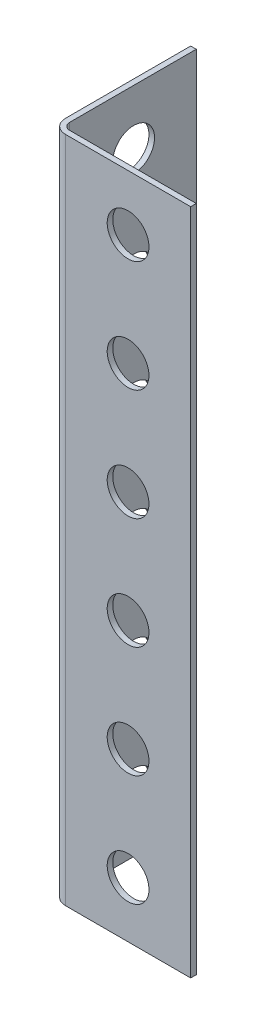
from build123d import *

# Parameters (mm, degrees)
BOSS_EXTRUDE1_DEPTH = 1219.2
SKETCH3_R           = 4.7625
CUT_EXTRUDE1_DEPTH  = 1.27
SKETCH4_R           = 4.7625
CUT_EXTRUDE2_DEPTH  = 1.27
FILLET1_R           = 3.175
FILLET2_R           = 1.5875
CUT_EXTRUDE3_DEPTH  = 1066.8


with BuildPart() as part:
    # Sketch1 → Boss-Extrude1 (new body)
    with BuildSketch(Plane(origin=(0, 0, 0), x_dir=(1, 0, 0), z_dir=(0, 1, 0))):
        Polygon((1.27, 1.27), (1.27, 30.48), (1.27, 31.75), (0, 31.75), (0, 0), (31.75, 0), (31.75, 1.27), (30.48, 1.27), align=None)
    extrude(amount=BOSS_EXTRUDE1_DEPTH)

    # Sketch3 → Cut-Extrude1 (cut)
    with BuildSketch(Plane.ZY):
        with Locations((-17.4625, 12.7)):
            Circle(SKETCH3_R)
        with Locations((-17.4625, 38.1)):
            Circle(SKETCH3_R)
        with Locations((-17.4625, 63.5)):
            Circle(SKETCH3_R)
        with Locations((-17.4625, 88.9)):
            Circle(SKETCH3_R)
        with Locations((-17.4625, 114.3)):
            Circle(SKETCH3_R)
        with Locations((-17.4625, 139.7)):
            Circle(SKETCH3_R)
        with Locations((-17.4625, 165.1)):
            Circle(SKETCH3_R)
        with Locations((-17.4625, 190.5)):
            Circle(SKETCH3_R)
        with Locations((-17.4625, 215.9)):
            Circle(SKETCH3_R)
        with Locations((-17.4625, 241.3)):
            Circle(SKETCH3_R)
        with Locations((-17.4625, 266.7)):
            Circle(SKETCH3_R)
        with Locations((-17.4625, 292.1)):
            Circle(SKETCH3_R)
        with Locations((-17.4625, 317.5)):
            Circle(SKETCH3_R)
        with Locations((-17.4625, 342.9)):
            Circle(SKETCH3_R)
        with Locations((-17.4625, 368.3)):
            Circle(SKETCH3_R)
        with Locations((-17.4625, 393.7)):
            Circle(SKETCH3_R)
        with Locations((-17.4625, 419.1)):
            Circle(SKETCH3_R)
        with Locations((-17.4625, 444.5)):
            Circle(SKETCH3_R)
        with Locations((-17.4625, 469.9)):
            Circle(SKETCH3_R)
        with Locations((-17.4625, 495.3)):
            Circle(SKETCH3_R)
        with Locations((-17.4625, 520.7)):
            Circle(SKETCH3_R)
        with Locations((-17.4625, 546.1)):
            Circle(SKETCH3_R)
        with Locations((-17.4625, 571.5)):
            Circle(SKETCH3_R)
        with Locations((-17.4625, 596.9)):
            Circle(SKETCH3_R)
        with Locations((-17.4625, 622.3)):
            Circle(SKETCH3_R)
        with Locations((-17.4625, 647.7)):
            Circle(SKETCH3_R)
        with Locations((-17.4625, 673.1)):
            Circle(SKETCH3_R)
        with Locations((-17.4625, 698.5)):
            Circle(SKETCH3_R)
        with Locations((-17.4625, 723.9)):
            Circle(SKETCH3_R)
        with Locations((-17.4625, 749.3)):
            Circle(SKETCH3_R)
        with Locations((-17.4625, 774.7)):
            Circle(SKETCH3_R)
        with Locations((-17.4625, 800.1)):
            Circle(SKETCH3_R)
        with Locations((-17.4625, 825.5)):
            Circle(SKETCH3_R)
        with Locations((-17.4625, 850.9)):
            Circle(SKETCH3_R)
        with Locations((-17.4625, 876.3)):
            Circle(SKETCH3_R)
        with Locations((-17.4625, 901.7)):
            Circle(SKETCH3_R)
        with Locations((-17.4625, 927.1)):
            Circle(SKETCH3_R)
        with Locations((-17.4625, 952.5)):
            Circle(SKETCH3_R)
        with Locations((-17.4625, 977.9)):
            Circle(SKETCH3_R)
        with Locations((-17.4625, 1003.3)):
            Circle(SKETCH3_R)
        with Locations((-17.4625, 1028.7)):
            Circle(SKETCH3_R)
        with Locations((-17.4625, 1054.1)):
            Circle(SKETCH3_R)
        with Locations((-17.4625, 1079.5)):
            Circle(SKETCH3_R)
        with Locations((-17.4625, 1104.9)):
            Circle(SKETCH3_R)
        with Locations((-17.4625, 1130.3)):
            Circle(SKETCH3_R)
        with Locations((-17.4625, 1155.7)):
            Circle(SKETCH3_R)
        with Locations((-17.4625, 1181.1)):
            Circle(SKETCH3_R)
        with Locations((-17.4625, 1206.5)):
            Circle(SKETCH3_R)
    extrude(amount=-CUT_EXTRUDE1_DEPTH, mode=Mode.SUBTRACT)

    # Sketch4 → Cut-Extrude2 (cut)
    with BuildSketch(Plane.XY):
        with Locations((17.4625, 1206.5)):
            Circle(SKETCH4_R)
        with Locations((17.4625, 1181.1)):
            Circle(SKETCH4_R)
        with Locations((17.4625, 1155.7)):
            Circle(SKETCH4_R)
        with Locations((17.4625, 1130.3)):
            Circle(SKETCH4_R)
        with Locations((17.4625, 1104.9)):
            Circle(SKETCH4_R)
        with Locations((17.4625, 1079.5)):
            Circle(SKETCH4_R)
        with Locations((17.4625, 1054.1)):
            Circle(SKETCH4_R)
        with Locations((17.4625, 1028.7)):
            Circle(SKETCH4_R)
        with Locations((17.4625, 1003.3)):
            Circle(SKETCH4_R)
        with Locations((17.4625, 977.9)):
            Circle(SKETCH4_R)
        with Locations((17.4625, 952.5)):
            Circle(SKETCH4_R)
        with Locations((17.4625, 927.1)):
            Circle(SKETCH4_R)
        with Locations((17.4625, 901.7)):
            Circle(SKETCH4_R)
        with Locations((17.4625, 876.3)):
            Circle(SKETCH4_R)
        with Locations((17.4625, 850.9)):
            Circle(SKETCH4_R)
        with Locations((17.4625, 825.5)):
            Circle(SKETCH4_R)
        with Locations((17.4625, 800.1)):
            Circle(SKETCH4_R)
        with Locations((17.4625, 774.7)):
            Circle(SKETCH4_R)
        with Locations((17.4625, 749.3)):
            Circle(SKETCH4_R)
        with Locations((17.4625, 723.9)):
            Circle(SKETCH4_R)
        with Locations((17.4625, 698.5)):
            Circle(SKETCH4_R)
        with Locations((17.4625, 673.1)):
            Circle(SKETCH4_R)
        with Locations((17.4625, 647.7)):
            Circle(SKETCH4_R)
        with Locations((17.4625, 622.3)):
            Circle(SKETCH4_R)
        with Locations((17.4625, 596.9)):
            Circle(SKETCH4_R)
        with Locations((17.4625, 571.5)):
            Circle(SKETCH4_R)
        with Locations((17.4625, 546.1)):
            Circle(SKETCH4_R)
        with Locations((17.4625, 520.7)):
            Circle(SKETCH4_R)
        with Locations((17.4625, 495.3)):
            Circle(SKETCH4_R)
        with Locations((17.4625, 469.9)):
            Circle(SKETCH4_R)
        with Locations((17.4625, 444.5)):
            Circle(SKETCH4_R)
        with Locations((17.4625, 419.1)):
            Circle(SKETCH4_R)
        with Locations((17.4625, 393.7)):
            Circle(SKETCH4_R)
        with Locations((17.4625, 368.3)):
            Circle(SKETCH4_R)
        with Locations((17.4625, 342.9)):
            Circle(SKETCH4_R)
        with Locations((17.4625, 317.5)):
            Circle(SKETCH4_R)
        with Locations((17.4625, 292.1)):
            Circle(SKETCH4_R)
        with Locations((17.4625, 266.7)):
            Circle(SKETCH4_R)
        with Locations((17.4625, 241.3)):
            Circle(SKETCH4_R)
        with Locations((17.4625, 215.9)):
            Circle(SKETCH4_R)
        with Locations((17.4625, 190.5)):
            Circle(SKETCH4_R)
        with Locations((17.4625, 165.1)):
            Circle(SKETCH4_R)
        with Locations((17.4625, 139.7)):
            Circle(SKETCH4_R)
        with Locations((17.4625, 114.3)):
            Circle(SKETCH4_R)
        with Locations((17.4625, 88.9)):
            Circle(SKETCH4_R)
        with Locations((17.4625, 63.5)):
            Circle(SKETCH4_R)
        with Locations((17.4625, 38.1)):
            Circle(SKETCH4_R)
        with Locations((17.4625, 12.7)):
            Circle(SKETCH4_R)
    extrude(amount=-CUT_EXTRUDE2_DEPTH, mode=Mode.SUBTRACT)

    # Fillet1
    fillet1_edges = [part.edges().sort_by_distance(p)[0] for p in [
        (0, 609.6, 0),
    ]]
    fillet(fillet1_edges, radius=FILLET1_R)

    # Fillet2
    fillet2_edges = [part.edges().sort_by_distance(p)[0] for p in [
        (1.27, 609.6, -1.27),
    ]]
    fillet(fillet2_edges, radius=FILLET2_R)

    # Sketch5 → Cut-Extrude3 (cut)
    with BuildSketch(Plane(origin=(0, 1219.2, 0), x_dir=(1, 0, 0), z_dir=(0, 1, 0))):
        with BuildLine():
            Line((0, 31.75), (0, 3.175))
            ThreePointArc((0, 3.175), (0.92993597, 0.92993597), (3.175, 0))
            Line((3.175, 0), (31.75, 0))
            Line((31.75, 0), (31.75, 1.27))
            Line((31.75, 1.27), (2.8575, 1.27))
            ThreePointArc((2.8575, 1.27), (1.734967985, 1.734967985), (1.27, 2.8575))
            Line((1.27, 2.8575), (1.27, 31.75))
            Line((1.27, 31.75), (0, 31.75))
        make_face()
    extrude(amount=-CUT_EXTRUDE3_DEPTH, mode=Mode.SUBTRACT)


solid = part.part
